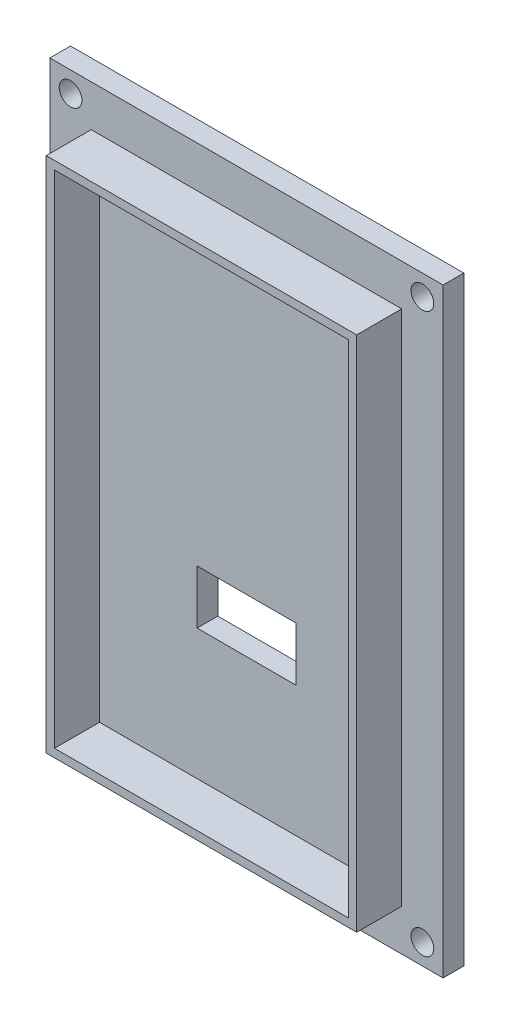
from build123d import *

# Parameters (mm, degrees)
SKETCH_231_W           = 38
SKETCH_231_H           = 58
EXTRUDE_279_DEPTH      = 2
PCB_2_W                = 30
PCB_2_H                = 50
PCB_2_W_2              = 28.4
PCB_2_H_2              = 48.4
PCB_DEPTH              = 4.35
SKETCH_X4_R            = 1.1
CUT_EXTRUDE_X4_DEPTH   = 64.96031973
TYPEC_2_W              = 9.54
TYPEC_2_H              = 5.2
TYPEC_DEPTH            = 64.96031973
SKETCH_613_W           = 3.959595959
SKETCH_613_H           = 0.444444444
CUT_EXTRUDE_1173_DEPTH = 0.3


with BuildPart() as part:
    # Sketch 231 → Extrude 279 (new body)
    with BuildSketch(Plane.XY.offset(-4.35)):
        with Locations((15, -25)):
            Rectangle(SKETCH_231_W, SKETCH_231_H)
    extrude(amount=-EXTRUDE_279_DEPTH)

    # PCB 2 → PCB (add)
    with BuildSketch(Plane.XY.offset(-4.35)):
        with Locations((15, -25)):
            Rectangle(PCB_2_W, PCB_2_H)
        with Locations((15, -25)):
            Rectangle(PCB_2_W_2, PCB_2_H_2, mode=Mode.SUBTRACT)
    extrude(amount=PCB_DEPTH)

    # 螺丝过孔x4_草图 → 螺丝过孔x4 (cut, through all)
    with BuildSketch(Plane.XY.offset(-4.35)):
        with Locations((-2, 2)):
            Circle(SKETCH_X4_R)
        with Locations((32, 2)):
            Circle(SKETCH_X4_R)
        with Locations((-2, -52)):
            Circle(SKETCH_X4_R)
        with Locations((32, -52)):
            Circle(SKETCH_X4_R)
    extrude(amount=-CUT_EXTRUDE_X4_DEPTH, mode=Mode.SUBTRACT)

    # TypeC 2 → TypeC (cut, through all)
    with BuildSketch(Plane.XY.offset(-4.35)):
        with Locations((15, -34)):
            Rectangle(TYPEC_2_W, TYPEC_2_H)
    extrude(amount=-TYPEC_DEPTH, mode=Mode.SUBTRACT)

    # Sketch 613 → Cut-Extrude 1173 (cut)
    # profile 1 of 5: a face of its own
    with BuildSketch(Plane.XY.offset(-6.35)):
        Polygon((15.315151515, -12.026262626), (15.433445567, -12.058249158), (15.551290685, -12.08956229), (15.668686869, -12.12020202), (15.785634119, -12.15016835), (15.902132435, -12.179461279), (16.018181818, -12.208080808), (15.901459035, -12.260493827), (15.772166105, -12.315375982), (15.63030303, -12.372727273), (15.475869809, -12.432547699), (15.308866442, -12.494837262), (15.129292929, -12.55959596), (15.177665544, -12.823905724), (15.233894501, -13.056565657), (15.297979798, -13.257575758), (15.369921437, -13.426936027), (15.449719416, -13.564646465), (15.537373737, -13.670707071), (15.638945006, -13.75342312), (15.760493827, -13.821099888), (15.902020202, -13.873737374), (16.06352413, -13.911335578), (16.245005612, -13.933894501), (16.446464646, -13.941414141), (17.707070707, -13.941414141), (18.055218855, -13.910213244), (18.34006734, -13.81661055), (18.561616162, -13.660606061), (18.71986532, -13.442199776), (18.814814815, -13.161391695), (18.846464646, -12.818181818), (18.846464646, -11), (17.795959596, -11), (17.795959596, -11.747474747), (17.432098765, -11.654657688), (17.075869809, -11.55667789), (16.727272727, -11.453535354), (16.38630752, -11.345230079), (16.052974186, -11.231762065), (15.727272727, -11.113131313), align=None)
        Polygon((17.795959596, -12.587878788), (17.795959596, -12.648484848), (17.784062851, -12.767003367), (17.748372615, -12.863973064), (17.688888889, -12.939393939), (17.605611672, -12.993265993), (17.498540965, -13.025589226), (17.367676768, -13.036363636), (16.713131313, -13.036363636), (16.618574635, -13.033333333), (16.534231201, -13.024242424), (16.46010101, -13.009090909), (16.396184063, -12.987878788), (16.342480359, -12.960606061), (16.298989899, -12.927272727), (16.261896745, -12.877665544), (16.227384961, -12.801571268), (16.195454545, -12.698989899), (16.166105499, -12.569921437), (16.139337823, -12.414365881), (16.115151515, -12.232323232), (16.399775533, -12.299438833), (16.682603816, -12.363411897), (16.963636364, -12.424242424), (17.242873176, -12.481930415), (17.520314254, -12.53647587), align=None, mode=Mode.SUBTRACT)
    # profile 2 of 5: a face of its own
    with BuildSketch(Plane.XY.offset(-6.35)):
        Polygon((23.048484848, -13.739393939), (23.145454545, -12.858585859), (20.826262626, -12.608080808), (20.826262626, -12.301010101), (22.927272727, -12.301010101), (22.927272727, -11.517171717), (20.826262626, -11.517171717), (20.826262626, -11.016161616), (19.775757576, -11.016161616), (19.775757576, -13.981818182), (20.826262626, -13.981818182), (20.826262626, -13.432323232), align=None)
    # profile 3 of 5: a face of its own
    with BuildSketch(Plane.XY.offset(-6.35)):
        Polygon((21.149494949, -18.935353535), (22.280808081, -18.935353535), (22.280808081, -14.272727273), (16.058585859, -14.272727273), (16.058585859, -17.690909091), (16.065039282, -17.859988777), (16.084399551, -18.014365881), (16.116666667, -18.154040404), (16.161840629, -18.279012346), (16.219921437, -18.389281706), (16.290909091, -18.484848485), (16.371043771, -18.567901235), (16.456565657, -18.640628507), (16.547474747, -18.703030303), (16.643771044, -18.755106622), (16.745454545, -18.796857464), (16.852525253, -18.828282828), (17.001627385, -18.852020202), (17.229405163, -18.870707071), (17.535858586, -18.884343434), (17.920987654, -18.892929293), (18.384792368, -18.896464646), (18.927272727, -18.894949495), (18.956902357, -18.748597082), (18.991919192, -18.595061728), (19.032323232, -18.434343434), (19.078114478, -18.2664422), (19.129292929, -18.091358025), (19.185858586, -17.909090909), (18.969135802, -17.916498316), (18.73647587, -17.922558923), (18.487878788, -17.927272727), (18.223344557, -17.930639731), (17.942873176, -17.932659933), (17.646464646, -17.933333333), (17.510325477, -17.919640853), (17.398204265, -17.878563412), (17.31010101, -17.81010101), (17.246015713, -17.714253648), (17.205948373, -17.591021324), (17.18989899, -17.44040404), (21.149494949, -17.44040404), align=None)
        with Locations((19.16969697, -15.319191919)):
            Rectangle(SKETCH_613_W, SKETCH_613_H, mode=Mode.SUBTRACT)
        with Locations((19.16969697, -16.490909091)):
            Rectangle(SKETCH_613_W, SKETCH_613_H, mode=Mode.SUBTRACT)
    # profile 4 of 5: a face of its own
    with BuildSketch(Plane.XY.offset(-6.35)):
        Polygon((14.903030303, -15.856565657), (14.673961841, -15.464197531), (14.468911336, -15.079012346), (14.287878788, -14.701010101), (14.130864198, -14.330190797), (13.997867565, -13.966554433), (13.888888889, -13.61010101), (14.83030303, -13.61010101), (14.83030303, -12.551515152), (13.876767677, -12.551515152), (13.876767677, -11.056565657), (12.826262626, -11.056565657), (12.826262626, -12.551515152), (11.96969697, -12.551515152), (11.96969697, -13.61010101), (12.826262626, -13.61010101), (12.826262626, -14.337373737), (12.661952862, -14.421099888), (12.494949495, -14.507968575), (12.325252525, -14.597979798), (12.152861953, -14.691133558), (11.977777778, -14.787429854), (11.8, -14.886868687), (12.309090909, -15.808080808), (12.389674523, -15.754208754), (12.472502806, -15.7003367), (12.557575758, -15.646464646), (12.644893378, -15.592592593), (12.734455668, -15.538720539), (12.826262626, -15.484848485), (12.826262626, -18.943434343), (13.876767677, -18.943434343), (13.876767677, -15.844444444), (13.982491582, -16.08630752), (14.094949495, -16.32704826), (14.214141414, -16.566666667), (14.34006734, -16.805162738), (14.472727273, -17.042536476), (14.612121212, -17.278787879), (14.660606061, -17.021548822), (14.709090909, -16.772390572), (14.757575758, -16.531313131), (14.806060606, -16.298316498), (14.854545455, -16.073400673), align=None)
    # profile 5 of 5: a face of its own
    with BuildSketch(Plane.XY.offset(-6.35)):
        Polygon((7.315151515, -11.161616162), (6.95959596, -12.244444444), (7.425589226, -12.325028058), (7.956228956, -12.399775533), (8.551515152, -12.468686869), (9.211447811, -12.531762065), (9.936026936, -12.589001122), (10.725252525, -12.64040404), (10.725252525, -13.408080808), (7.193939394, -13.408080808), (7.193939394, -14.442424242), (7.331088664, -14.91694725), (7.489337823, -15.370819304), (7.668686869, -15.804040404), (7.869135802, -16.21661055), (8.090684624, -16.608529742), (8.333333333, -16.97979798), (8.117171717, -17.16026936), (7.888888889, -17.321885522), (7.648484848, -17.464646465), (7.395959596, -17.588552189), (7.131313131, -17.693602694), (6.854545455, -17.77979798), (6.978002245, -17.95959596), (7.100561167, -18.148821549), (7.222222222, -18.347474747), (7.34298541, -18.555555556), (7.46285073, -18.773063973), (7.581818182, -19), (7.858698092, -18.837934905), (8.123681257, -18.664197531), (8.376767677, -18.478787879), (8.617957351, -18.281705948), (8.847250281, -18.07295174), (9.064646465, -17.852525253), (9.295061728, -18.069360269), (9.53647587, -18.275420875), (9.788888889, -18.470707071), (10.052300786, -18.655218855), (10.32671156, -18.828956229), (10.612121212, -18.991919192), (10.714702581, -18.806060606), (10.817732884, -18.625589226), (10.921212121, -18.450505051), (11.025140292, -18.280808081), (11.129517396, -18.116498316), (11.234343434, -17.957575758), (10.954320988, -17.812906846), (10.687991021, -17.659034792), (10.435353535, -17.495959596), (10.19640853, -17.323681257), (9.971156004, -17.142199776), (9.75959596, -16.951515152), (9.919753086, -16.68047138), (10.068911336, -16.397979798), (10.207070707, -16.104040404), (10.334231201, -15.798653199), (10.450392817, -15.481818182), (10.555555556, -15.153535354), (9.771717172, -14.442424242), (10.725252525, -14.442424242), (10.725252525, -15.121212121), (10.759371493, -15.864197531), (10.861728395, -16.568574635), (11.032323232, -17.234343434), (11.271156004, -17.861503928), (11.578226712, -18.450056117), (11.953535354, -19), (12.086195286, -18.835241302), (12.22020202, -18.674971942), (12.355555556, -18.519191919), (12.492255892, -18.367901235), (12.63030303, -18.221099888), (12.76969697, -18.078787879), (12.465993266, -17.652076319), (12.217508418, -17.169248036), (12.024242424, -16.63030303), (11.886195286, -16.035241302), (11.803367003, -15.384062851), (11.775757576, -14.676767677), (11.775757576, -11.58989899), (10.846015713, -11.539842873), (9.990796857, -11.481257015), (9.21010101, -11.414141414), (8.503928171, -11.338496072), (7.872278339, -11.254320988), align=None)
        Polygon((9.052525253, -16.115151515), (8.897418631, -15.862177329), (8.758024691, -15.598877666), (8.634343434, -15.325252525), (8.52637486, -15.041301908), (8.434118967, -14.747025814), (8.357575758, -14.442424242), (9.763636364, -14.442424242), (9.668686869, -14.758249158), (9.564309764, -15.059259259), (9.450505051, -15.345454545), (9.327272727, -15.616835017), (9.194612795, -15.873400673), align=None, mode=Mode.SUBTRACT)
    extrude(amount=CUT_EXTRUDE_1173_DEPTH, mode=Mode.SUBTRACT)


solid = part.part
